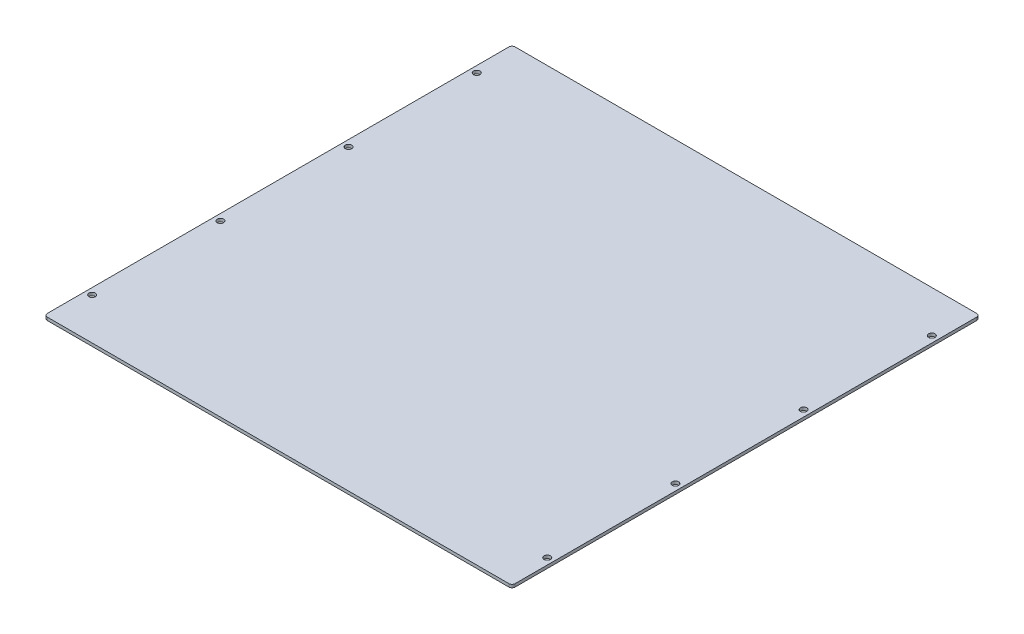
from build123d import *

# Parameters (mm, degrees)
SKETCH1_W                   = 463.55
SKETCH1_H                   = 463.55
BOSS_EXTRUDE1_DEPTH         = 2.9972
FILLET1_R                   = 3.175
F_1_4_0_25_DIAMETER_HOLE1_D = 6.35


with BuildPart() as part:
    # Sketch1 → Boss-Extrude1 (new body)
    with BuildSketch(Plane(origin=(0, 0, 0), x_dir=(1, 0, 0), z_dir=(0, 1, 0))):
        Rectangle(SKETCH1_W, SKETCH1_H)
    extrude(amount=BOSS_EXTRUDE1_DEPTH)

    # Fillet1
    fillet1_edges = [part.edges().sort_by_distance(p)[0] for p in [
        (231.775, 1.4986, 231.775),
        (-231.775, 1.4986, 231.775),
        (-231.775, 1.4986, -231.775),
        (231.775, 1.4986, -231.775),
    ]]
    fillet(fillet1_edges, radius=FILLET1_R)

    # 1/4 (0.25) Diameter Hole1 (through all)
    with Locations(Plane(origin=(0, 2.9972, 0), x_dir=(1, 0, 0), z_dir=(0, 1, 0))):
        with Locations((-225.425, 190.5), (225.425, 190.5), (225.425, 63.5), (225.425, -63.5), (225.425, -190.5), (-225.425, 63.5), (-225.425, -63.5), (-225.425, -190.5)):
            Hole(F_1_4_0_25_DIAMETER_HOLE1_D / 2)


solid = part.part
